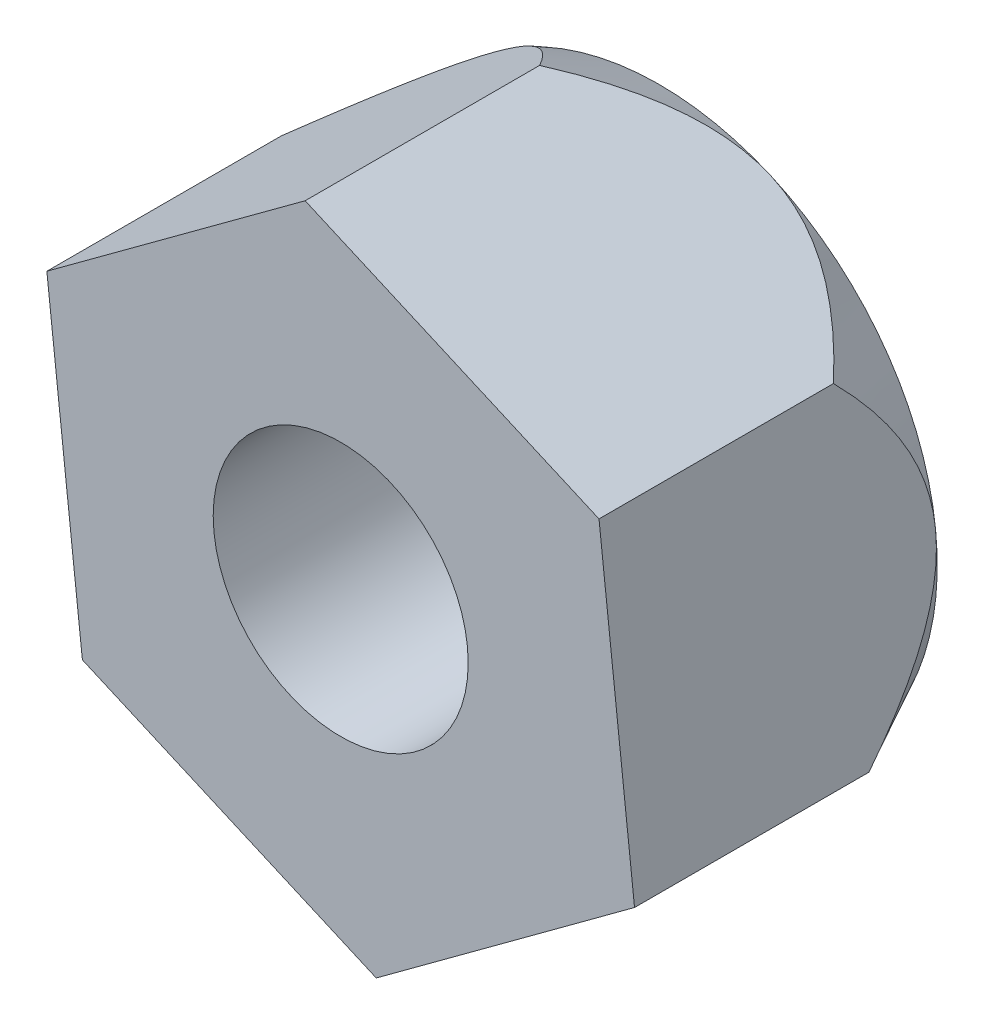
from build123d import *

# Parameters (mm, degrees)
BOSS_EXTRUDE2_DEPTH = 5
SKETCH2_R           = 2
CUT_EXTRUDE1_DEPTH  = 9.440506234
SKETCH3_OUTSIDE_W   = 19.212
SKETCH3_OUTSIDE_H   = 19.994
SKETCH3_OUTSIDE_R   = 4.356968777
CUT_EXTRUDE2_DEPTH  = 5
CUT_EXTRUDE2_DRAFT  = -27


with BuildPart() as part:
    # Sketch1 → Boss-Extrude2 (new body)
    with BuildSketch(Plane.XY):
        Polygon((4.608920208, -2.017116032), (4.05133383, 2.982883968), (-0.557586378, 5), (-4.608920208, 2.017116032), (-4.05133383, -2.982883968), (0.557586378, -5), align=None)
    extrude(amount=BOSS_EXTRUDE2_DEPTH)

    # Sketch2 → Cut-Extrude1 (cut, through all)
    with BuildSketch(Plane(origin=(0, 0, 0), x_dir=(-1, 0, 0), z_dir=(0, 0, -1))):
        Circle(SKETCH2_R)
    extrude(amount=-CUT_EXTRUDE1_DEPTH, mode=Mode.SUBTRACT)


with BuildPart() as cut_extrude2_tool:
    # Sketch3 outside → Cut-Extrude2 (with draft: the straight prism first)
    with BuildSketch(Plane(origin=(0, 0, 0), x_dir=(-1, 0, 0), z_dir=(0, 0, -1))):
        Rectangle(SKETCH3_OUTSIDE_W, SKETCH3_OUTSIDE_H)
        Circle(SKETCH3_OUTSIDE_R, mode=Mode.SUBTRACT)
    extrude(amount=-CUT_EXTRUDE2_DEPTH)
    # Cut-Extrude2: the draft: its side faces are tilted about the plane it starts from
    cut_extrude2_sides = [cut_extrude2_tool.faces().sort_by_distance(p)[0] for p in [
        (0, -9.997, 2.5),
        (-9.606, 0, 2.5),
        (0, 9.997, 2.5),
        (9.606, 0, 2.5),
        (4.356968777, 0, 2.5),
    ]]
    draft(cut_extrude2_sides, Plane(origin=(0, 0, 0), x_dir=(-1, 0, 0), z_dir=(0, 0, -1)), CUT_EXTRUDE2_DRAFT)


with BuildPart() as part_1:
    add(part.part)

    # Cut-Extrude2: cut by cut_extrude2_tool
    add(cut_extrude2_tool.part, mode=Mode.SUBTRACT)


solid = part_1.part
